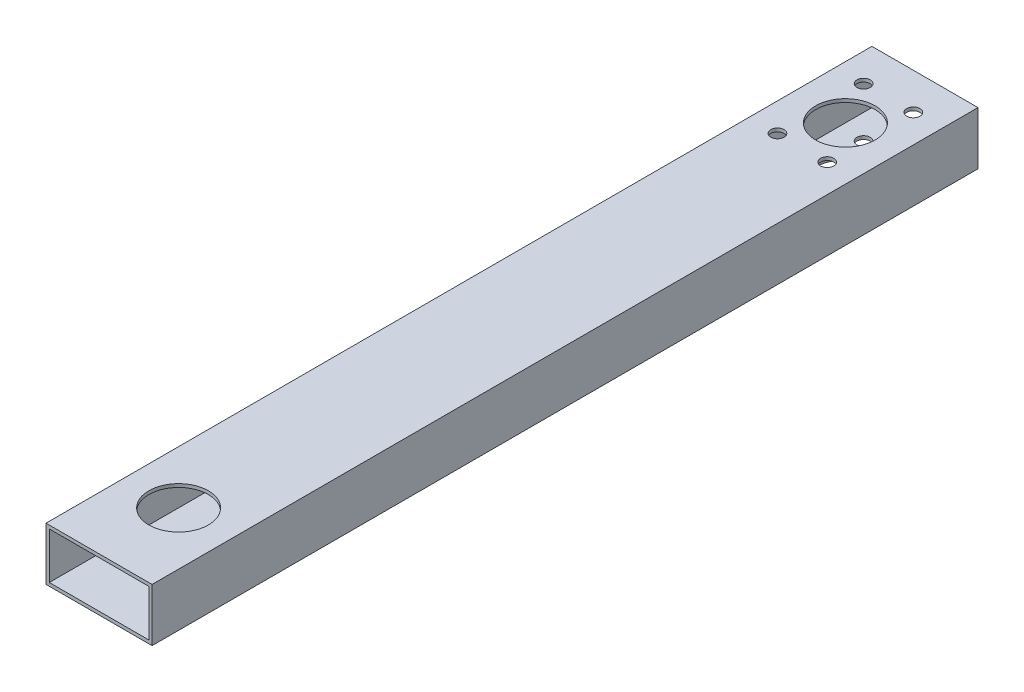
from build123d import *

# Parameters (mm, degrees)
SKETCH1_W               = 50.8
SKETCH1_H               = 25.4
SKETCH1_W_2             = 47.625
SKETCH1_H_2             = 22.225
BOSS_EXTRUDE1_DEPTH     = 395.478
CUT_EXTRUDE1_DEPTH      = 400.535540952
CUT_EXTRUDE1_DEPTH_BACK = 400.535540952
SKETCH2_R               = 14.224
SKETCH2_R_2             = 3.175


with BuildPart() as part:
    # Sketch1 → Boss-Extrude1 (new body)
    with BuildSketch(Plane.XY):
        with Locations((25.4, 12.7)):
            Rectangle(SKETCH1_W, SKETCH1_H)
        with Locations((25.4, 12.7)):
            Rectangle(SKETCH1_W_2, SKETCH1_H_2, mode=Mode.SUBTRACT)
    extrude(amount=BOSS_EXTRUDE1_DEPTH)

    # Sketch2 → Cut-Extrude1 (cut, two sides: drawn at the far end of the back side and taken through both)
    with BuildSketch(Plane(origin=(0, 25.4, 0), x_dir=(1, 0, 0), z_dir=(0, 1, 0)).offset(-CUT_EXTRUDE1_DEPTH_BACK)):
        with Locations(Location((25.4, -38.1, 0), (0, 0, 90))):
            Circle(SKETCH2_R)
        with Locations(Location((13.49375, -17.477770072, 0), (0, 0, 90))):
            Circle(SKETCH2_R_2)
        with Locations(Location((13.49375, -58.722229928, 0), (0, 0, 90))):
            Circle(SKETCH2_R_2)
        with Locations(Location((37.30625, -58.722229928, 0), (0, 0, 90))):
            Circle(SKETCH2_R_2)
        with Locations(Location((37.30625, -17.477770072, 0), (0, 0, 90))):
            Circle(SKETCH2_R_2)
        with Locations(Location((25.4, -357.378, 0), (0, 0, 90))):
            Circle(SKETCH2_R)
    extrude(amount=CUT_EXTRUDE1_DEPTH + CUT_EXTRUDE1_DEPTH_BACK, mode=Mode.SUBTRACT)


solid = part.part
